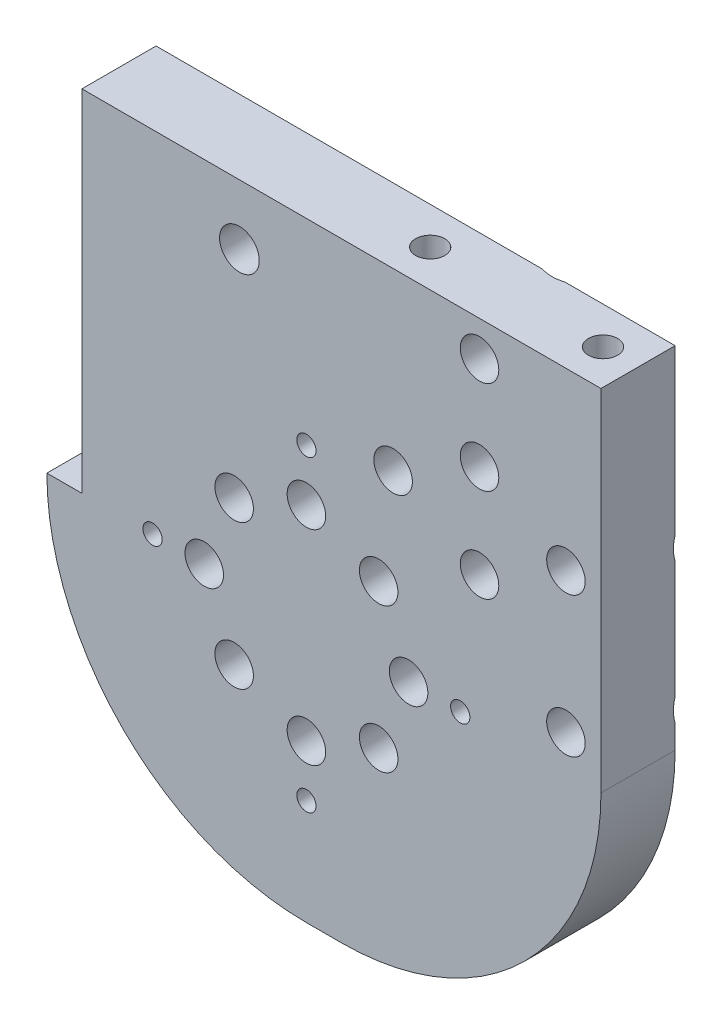
from build123d import *

# Parameters (mm, degrees)
BOSS_EXTRUDE1_DEPTH                                 = 12.7
F_4_CLEARANCE_HOLE1_D                               = 3.3
F_1_4_CLEARANCE_HOLE1_D                             = 6.6
F_1_4_CLEARANCE_HOLE2_D                             = 6.8
CSK_FOR_1_4_FLAT_HEAD_MACHINE_SCREW_100_D           = 6.6
CSK_FOR_1_4_FLAT_HEAD_MACHINE_SCREW_100_CSINK_D     = 12.6
CSK_FOR_1_4_FLAT_HEAD_MACHINE_SCREW_100_CSINK_ANGLE = 90
F_10_CLEARANCE_HOLE1_D                              = 5
F_10_CLEARANCE_HOLE1_DEPTH                          = 15
F_10_CLEARANCE_HOLE2_D                              = 5
F_10_CLEARANCE_HOLE2_DEPTH                          = 10
F_1_3_4_CLEARANCE_HOLE1_D                           = 45
F_1_3_4_CLEARANCE_HOLE1_DEPTH                       = 5
F_1_4_CLEARANCE_HOLE3_D                             = 6.6
F_1_4_CLEARANCE_HOLE3_DEPTH                         = 12.7
CHAMFER1_SIZE                                       = 3
BOSS_EXTRUDE2_DEPTH                                 = 12.7
SKETCH_1_W                                          = 126.874345958
SKETCH_1_H                                          = 130.303382335
CUT_EXTRUDE_1_DEPTH                                 = 153.24885057
SKETCH_4_W                                          = 119.865204769
SKETCH_4_H                                          = 136.067011153
CUT_EXTRUDE_3_DEPTH                                 = 153.24885057
SKETCH_5_W                                          = 104.888171539
SKETCH_5_H                                          = 121.024813314
CUT_EXTRUDE_4_DEPTH                                 = 153.24885057


with BuildPart() as part:
    # Sketch1 → Boss-Extrude1 (new body)
    with BuildSketch(Plane(origin=(0, 0, 0), x_dir=(-1, 0, 0), z_dir=(0, 0, -1))):
        with BuildLine():
            Line((44.45, 0), (44.45, 60))
            Line((44.45, 60), (-44.45, 60))
            Line((-44.45, 60), (-44.45, 0))
            ThreePointArc((-44.45, 0), (0, -44.45), (44.45, 0))
        make_face()
    extrude(amount=-BOSS_EXTRUDE1_DEPTH)

    # #4 Clearance Hole1 (through all)
    with Locations(Plane.XY.offset(12.7)):
        with Locations((32.349998458, 0.009014041), (6, -26.35), (-20.349998115, -0.009967087), (6, 26.35)):
            Hole(F_4_CLEARANCE_HOLE1_D / 2)

    # 1/4 Clearance Hole1 (through all)
    with Locations(Plane(origin=(0, 0, 0), x_dir=(-1, 0, 0), z_dir=(0, 0, -1))):
        with Locations((8.85, 30), (23.65, 38), (23.65, 22)):
            Hole(F_1_4_CLEARANCE_HOLE1_D / 2)

    # 1/4 Clearance Hole2 (through all)
    with Locations(Plane.XY.offset(12.7)):
        with Locations((17.47250377, 49.692873304)):
            Hole(F_1_4_CLEARANCE_HOLE2_D / 2)

    # CSK for 1/4 Flat Head Machine Screw (100)1 (through all)
    with Locations(Plane(origin=(0, 0, 0), x_dir=(-1, 0, 0), z_dir=(0, 0, -1))):
        with Locations((23.65, 54), (38.45, 6), (38.45, 30)):
            CounterSinkHole(CSK_FOR_1_4_FLAT_HEAD_MACHINE_SCREW_100_D / 2, CSK_FOR_1_4_FLAT_HEAD_MACHINE_SCREW_100_CSINK_D / 2, counter_sink_angle=CSK_FOR_1_4_FLAT_HEAD_MACHINE_SCREW_100_CSINK_ANGLE)

    # #10 Clearance Hole1
    with Locations(Plane(origin=(0, 60, 0), x_dir=(1, 0, 0), z_dir=(0, 1, 0))):
        with Locations((-38.45, -6.35), (-8.85, -6.35)):
            Hole(F_10_CLEARANCE_HOLE1_D / 2, depth=F_10_CLEARANCE_HOLE1_DEPTH)

    # #10 Clearance Hole2
    with Locations(Plane(origin=(44.45, 0, 0), x_dir=(0, 0, -1), z_dir=(1, 0, 0))):
        with Locations((-6.35, 7), (-6.35, 53), (-6.35, 30)):
            Hole(F_10_CLEARANCE_HOLE2_D / 2, depth=F_10_CLEARANCE_HOLE2_DEPTH)

    # 1-3/4 Clearance Hole1
    with Locations(Plane(origin=(0, 0, 0), x_dir=(-1, 0, 0), z_dir=(0, 0, -1))):
        with Locations((-6, 0)):
            Hole(F_1_3_4_CLEARANCE_HOLE1_D / 2, depth=F_1_3_4_CLEARANCE_HOLE1_DEPTH)

    # 1/4 Clearance Hole3
    with Locations(Plane.XY.offset(12.7)):
        with Locations((18.374368671, 12.374368671), (23.499999956, -0.001247108), (18.374368671, -12.374368671), (6, -17.5), (-6.374368671, -12.374368671), (-11.5, 0), (-6.374368671, 12.374368671), (6, 17.5)):
            Hole(F_1_4_CLEARANCE_HOLE3_D / 2, depth=F_1_4_CLEARANCE_HOLE3_DEPTH)

    # Chamfer1
    chamfer1_edges = [part.edges().sort_by_distance(p)[0] for p in [
        (-26.95, 22, 0),
        (-26.95, 38, 0),
        (-12.15, 30, 0),
    ]]
    chamfer(chamfer1_edges, length=CHAMFER1_SIZE)

    # Sketch18 → Boss-Extrude2 (add)
    with BuildSketch(Plane(origin=(0, 0, 0), x_dir=(-1, 0, 0), z_dir=(0, 0, -1))):
        with BuildLine():
            Line((-44.45, 0), (-50.45, 0))
            ThreePointArc((-50.45, 0), (-37.430896424, -31.430896424), (-6, -44.45))
            Line((-6, -44.45), (0, -44.45))
            ThreePointArc((0, -44.45), (-31.430896424, -31.430896424), (-44.45, 0))
        make_face()
    extrude(amount=-BOSS_EXTRUDE2_DEPTH)

    # 镜向1: part across plane


with BuildPart() as part_1:
    add(part.part)
    add(part.part.mirror(Plane(origin=(-44.45, 0, 12.7), x_dir=(0, 0, 1), z_dir=(-1, 0, 0))))

    # 草图1 → 切除-拉伸1 (cut, through all)
    with BuildSketch(Plane(origin=(0, 0, 0), x_dir=(-1, 0, 0), z_dir=(0, 0, -1))):
        with Locations((-18.987172979, 5.0519417)):
            Rectangle(SKETCH_1_W, SKETCH_1_H)
    extrude(amount=-CUT_EXTRUDE_1_DEPTH, mode=Mode.SUBTRACT)

    # 镜向3: part across plane


with BuildPart() as part_2:
    add(part_1.part)
    add(part_1.part.mirror(Plane(origin=(-44.45, 70.203632868, 12.7), x_dir=(0, 0, 1), z_dir=(-1, 0, 0))))

    # 草图4 → 切除-拉伸3 (cut, through all)
    with BuildSketch(Plane.XY.offset(12.7)):
        with Locations((-104.382602385, 0.979374439)):
            Rectangle(SKETCH_4_W, SKETCH_4_H)
    extrude(amount=-CUT_EXTRUDE_3_DEPTH, mode=Mode.SUBTRACT)

    # 镜向4: part across plane


with BuildPart() as part_3:
    add(part_2.part)
    add(part_2.part.mirror(Plane(origin=(-44.45, 69.012880015, -0.376548638), x_dir=(0, 0, 1), z_dir=(1, 0, 0))))

    # 草图5 → 切除-拉伸4 (cut, through all)
    with BuildSketch(Plane.XY.offset(12.7)):
        with Locations((7.994085769, 7.674145989)):
            Rectangle(SKETCH_5_W, SKETCH_5_H)
    extrude(amount=-CUT_EXTRUDE_4_DEPTH, mode=Mode.SUBTRACT)


solid = part_3.part
